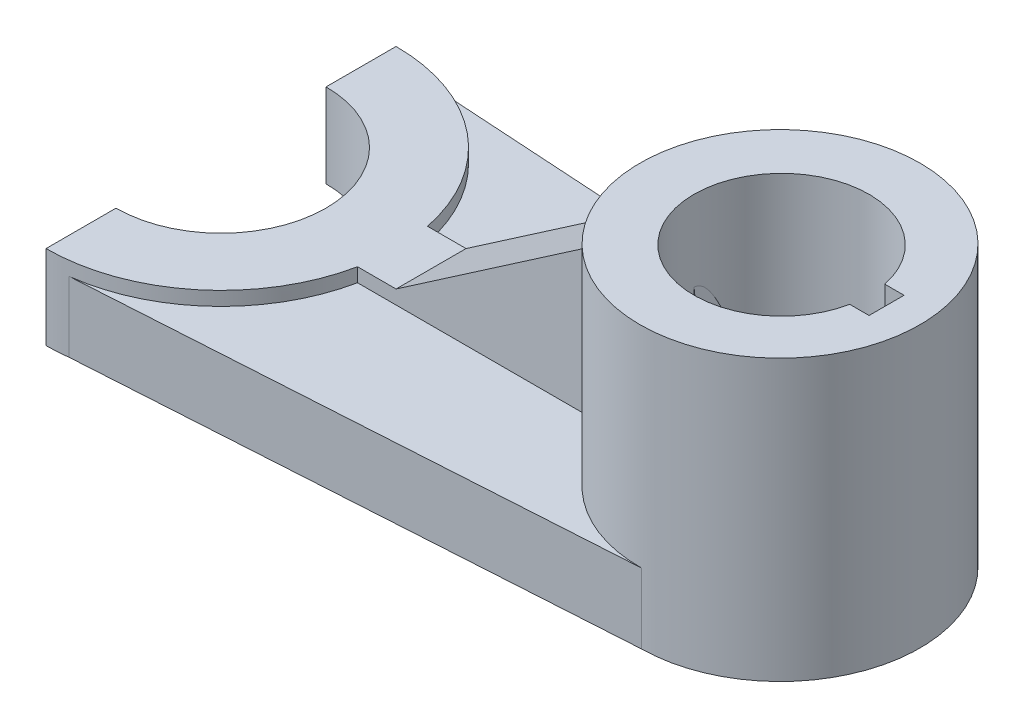
from build123d import *

# Parameters (mm, degrees)
BOSS_EXTRUDE2_DEPTH = 10.01387566
BOSS_EXTRUDE3_DEPTH = 12
SKETCH18_R          = 20
BOSS_EXTRUDE6_DEPTH = 40
SKETCH26_R          = 12.5
CUT_EXTRUDE2_DEPTH  = 40
CUT_EXTRUDE5_DEPTH  = 40
BOSS_EXTRUDE8_DEPTH = 5
BOSS_EXTRUDE9_DEPTH = 5


with BuildPart() as part:
    # Sketch1 → Boss-Extrude2 (new body)
    with BuildSketch(Plane(origin=(0, 0, 0), x_dir=(1, 0, 0), z_dir=(0, 1, 0))):
        with BuildLine():
            Line((-40, -25), (-40, -15))
            ThreePointArc((-40, -15), (-25, 0), (-40, 15))
            Line((-40, 15), (-40, 25))
            Line((-40, 25), (40.060765138, 20))
            Line((40.060765138, 20), (40.060765138, -20))
            Line((40.060765138, -20), (-40, -25))
        make_face()
    extrude(amount=BOSS_EXTRUDE2_DEPTH)

    # Sketch17 → Boss-Extrude3 (add)
    with BuildSketch(Plane(origin=(0, 0, 0), x_dir=(1, 0, 0), z_dir=(0, 1, 0))):
        with BuildLine():
            Line((-40, 25), (-40, 15))
            ThreePointArc((-40, 15), (-25, 0), (-40, -15))
            Line((-40, -15), (-40, -25))
            ThreePointArc((-40, -25), (-15, 0), (-40, 25))
        make_face()
    extrude(amount=BOSS_EXTRUDE3_DEPTH)

    # Sketch18 → Boss-Extrude6 (add)
    with BuildSketch(Plane(origin=(0, 0, 0), x_dir=(1, 0, 0), z_dir=(0, 1, 0))):
        with Locations(Location((39.84238711, 0, 0), (0, 0, 89.374380602))):
            Circle(SKETCH18_R)
    extrude(amount=BOSS_EXTRUDE6_DEPTH)

    # Sketch26 → Cut-Extrude2 (cut)
    with BuildSketch(Plane(origin=(0, 0, 0), x_dir=(1, 0, 0), z_dir=(0, 1, 0))):
        with Locations(Location((40.060765138, 0, 0), (0, 0, 270))):
            Circle(SKETCH26_R)
    extrude(amount=CUT_EXTRUDE2_DEPTH, mode=Mode.SUBTRACT)

    # Sketch27 → Cut-Extrude5 (cut)
    with BuildSketch(Plane(origin=(0, 0, 0), x_dir=(1, 0, 0), z_dir=(0, 1, 0))):
        with BuildLine():
            Line((55.060765138, 2.499608634), (52.235862007, 2.499608634))
            ThreePointArc((52.235862007, 2.499608634), (52.426066383, 1.256530998), (52.489684933, 0.00059613))
            ThreePointArc((52.489684933, 0.00059613), (52.426015439, -1.255840203), (52.235659276, -2.49940387))
            Line((52.235659276, -2.49940387), (55.060765138, -2.49940387))
            Line((55.060765138, -2.49940387), (55.060765138, 0.00059613))
            Line((55.060765138, 0.00059613), (55.060765138, 2.499608634))
        make_face()
    extrude(amount=CUT_EXTRUDE5_DEPTH, mode=Mode.SUBTRACT)

    # Sketch35 → Boss-Extrude8 (add)
    with BuildSketch(Plane.XY):
        Polygon((-15, 12), (-10, 12), (19.84238711, 32.5), (25.015627371, 36.053717903), (26.363273424, 32.5), (25.450319422, 10.01387566), (19.84238711, 10.01387566), (-15, 10.01387566), (-18.557885477, 10.01387566), (-18.07381102, 12), align=None)
    extrude(amount=BOSS_EXTRUDE8_DEPTH)

    # Sketch41 → Boss-Extrude9 (add)
    with BuildSketch(Plane.XY):
        Polygon((19.84238711, 32.5), (-10, 12), (-16.624555897, 12), (-16.624555897, 10.01387566), (29.789890708, 10.01387566), (27.477800575, 29.176181785), (25.597486792, 36.45342179), align=None)
    extrude(amount=-BOSS_EXTRUDE9_DEPTH)


solid = part.part
